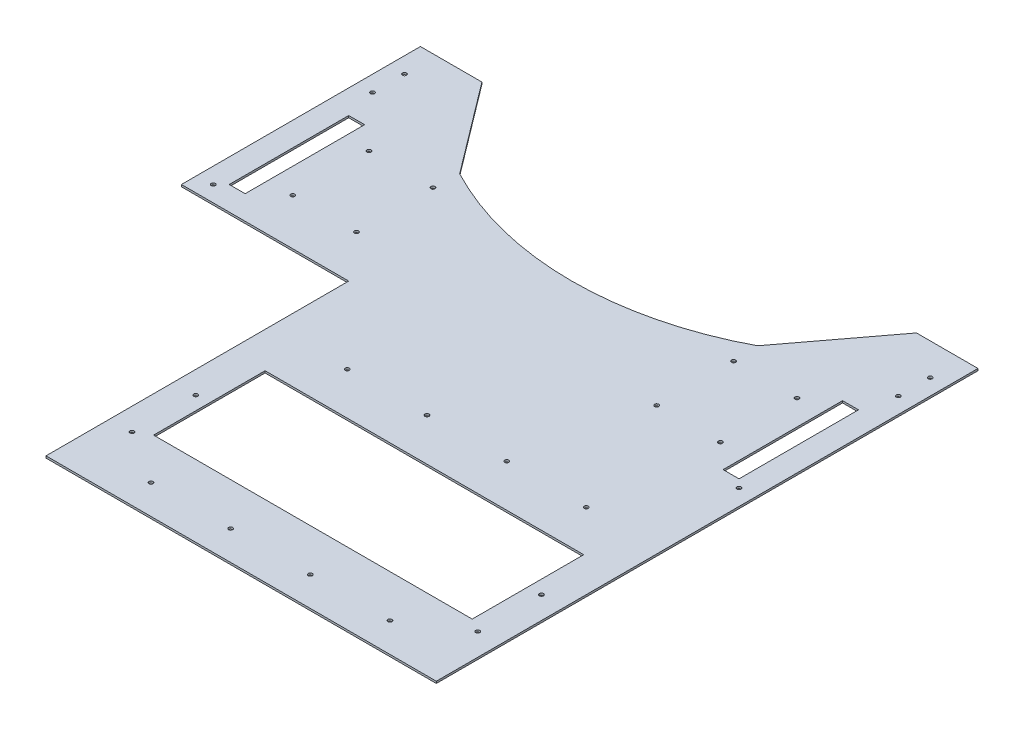
from build123d import *

# Parameters (mm, degrees)
SKETCH1_R           = 1.63195
SKETCH1_W           = 254
SKETCH1_H           = 88.9
SKETCH1_W_2         = 12.7
SKETCH1_H_2         = 95.25
BOSS_EXTRUDE1_DEPTH = 1.5875
CUT_EXTRUDE1_REACH  = 621.705
SKETCH2_R           = 1.63195
CUT_EXTRUDE2_REACH  = 621.705
SKETCH4_R           = 1.63195


with BuildPart() as part:
    # Sketch1 → Boss-Extrude1 (new body)
    with BuildSketch(Plane(origin=(0, 0, 0), x_dir=(1, 0, 0), z_dir=(0, 1, 0))):
        with BuildLine():
            Line((-444.5, 431.8), (-395.456941666, 431.8))
            Line((-395.456941666, 431.8), (-340.943704665, 359.56166268))
            ThreePointArc((-340.943704665, 359.56166268), (-222.25, 330.203093028), (-103.556295335, 359.56166268))
            Line((-103.556295335, 359.56166268), (-49.043058334, 431.8))
            Line((-49.043058334, 431.8), (0, 431.8))
            Line((0, 431.8), (0, 0))
            Line((0, 0), (-311.15, 0))
            Line((-311.15, 0), (-311.15, 241.3))
            Line((-311.15, 241.3), (-444.5, 241.3))
            Line((-444.5, 241.3), (-444.5, 431.8))
        make_face()
        with Locations(Location((-250.825, 23.368, 0), (0, 0, 270))):
            Circle(SKETCH1_R, mode=Mode.SUBTRACT)
        with Locations(Location((-187.325, 23.368, 0), (0, 0, 270))):
            Circle(SKETCH1_R, mode=Mode.SUBTRACT)
        with Locations(Location((-187.325, 179.8955, 0), (0, 0, 270))):
            Circle(SKETCH1_R, mode=Mode.SUBTRACT)
        with Locations(Location((-250.825, 179.8955, 0), (0, 0, 270))):
            Circle(SKETCH1_R, mode=Mode.SUBTRACT)
        with Locations(Location((-123.825, 179.8955, 0), (0, 0, 270))):
            Circle(SKETCH1_R, mode=Mode.SUBTRACT)
        with Locations(Location((-60.325, 179.8955, 0), (0, 0, 270))):
            Circle(SKETCH1_R, mode=Mode.SUBTRACT)
        with Locations(Location((-123.825, 23.368, 0), (0, 0, 270))):
            Circle(SKETCH1_R, mode=Mode.SUBTRACT)
        with Locations(Location((-60.325, 23.368, 0), (0, 0, 270))):
            Circle(SKETCH1_R, mode=Mode.SUBTRACT)
        with Locations((-155.575, 101.63175)):
            Rectangle(SKETCH1_W, SKETCH1_H, mode=Mode.SUBTRACT)
        with Locations((-25.4, 307.975)):
            Rectangle(SKETCH1_W_2, SKETCH1_H_2, mode=Mode.SUBTRACT)
        with Locations((-419.1, 307.975)):
            Rectangle(SKETCH1_W_2, SKETCH1_H_2, mode=Mode.SUBTRACT)
    extrude(amount=BOSS_EXTRUDE1_DEPTH)

    # Sketch2 → Cut-Extrude1 (cut, up to next)
    with BuildSketch(Plane(origin=(0, 1.5875, 0), x_dir=(1, 0, 0), z_dir=(0, 1, 0)), mode=Mode.PRIVATE) as cut_extrude1_sk1:
        with Locations(Location((-293.37, 101.6, 0), (0, 0, 270))):
            Circle(SKETCH2_R)
    cut_extrude1_tool1 = extrude(cut_extrude1_sk1.sketch, amount=-CUT_EXTRUDE1_REACH, mode=Mode.PRIVATE) & part.part
    # Sketch2 → Cut-Extrude1 (cut, up to next)
    with BuildSketch(Plane(origin=(0, 1.5875, 0), x_dir=(1, 0, 0), z_dir=(0, 1, 0)), mode=Mode.PRIVATE) as cut_extrude1_sk2:
        with Locations(Location((-293.37, 50.8, 0), (0, 0, 270))):
            Circle(SKETCH2_R)
    cut_extrude1_tool2 = extrude(cut_extrude1_sk2.sketch, amount=-CUT_EXTRUDE1_REACH, mode=Mode.PRIVATE) & part.part
    # Sketch2 → Cut-Extrude1 (cut, up to next)
    with BuildSketch(Plane(origin=(0, 1.5875, 0), x_dir=(1, 0, 0), z_dir=(0, 1, 0)), mode=Mode.PRIVATE) as cut_extrude1_sk3:
        with Locations(Location((-17.78, 101.6, 0), (0, 0, 270))):
            Circle(SKETCH2_R)
    cut_extrude1_tool3 = extrude(cut_extrude1_sk3.sketch, amount=-CUT_EXTRUDE1_REACH, mode=Mode.PRIVATE) & part.part
    # Sketch2 → Cut-Extrude1 (cut, up to next)
    with BuildSketch(Plane(origin=(0, 1.5875, 0), x_dir=(1, 0, 0), z_dir=(0, 1, 0)), mode=Mode.PRIVATE) as cut_extrude1_sk4:
        with Locations(Location((-17.78, 50.8, 0), (0, 0, 270))):
            Circle(SKETCH2_R)
    cut_extrude1_tool4 = extrude(cut_extrude1_sk4.sketch, amount=-CUT_EXTRUDE1_REACH, mode=Mode.PRIVATE) & part.part
    add(cut_extrude1_tool1.solids().sort_by_distance((-293.37, 1.5875, -101.6))[0], mode=Mode.SUBTRACT)
    add(cut_extrude1_tool2.solids().sort_by_distance((-293.37, 1.5875, -50.8))[0], mode=Mode.SUBTRACT)
    add(cut_extrude1_tool3.solids().sort_by_distance((-17.78, 1.5875, -101.6))[0], mode=Mode.SUBTRACT)
    add(cut_extrude1_tool4.solids().sort_by_distance((-17.78, 1.5875, -50.8))[0], mode=Mode.SUBTRACT)

    # Sketch4 → Cut-Extrude2 (cut, up to next)
    with BuildSketch(Plane(origin=(0, 1.5875, 0), x_dir=(1, 0, 0), z_dir=(0, 1, 0)), mode=Mode.PRIVATE) as cut_extrude2_sk1:
        with Locations(Location((-102.439928105, 339.392140239, 0), (0, 0, 270))):
            Circle(SKETCH4_R)
    cut_extrude2_tool1 = extrude(cut_extrude2_sk1.sketch, amount=-CUT_EXTRUDE2_REACH, mode=Mode.PRIVATE) & part.part
    # Sketch4 → Cut-Extrude2 (cut, up to next)
    with BuildSketch(Plane(origin=(0, 1.5875, 0), x_dir=(1, 0, 0), z_dir=(0, 1, 0)), mode=Mode.PRIVATE) as cut_extrude2_sk2:
        with Locations(Location((-51.640295705, 339.198883781, 0), (0, 0, 270))):
            Circle(SKETCH4_R)
    cut_extrude2_tool2 = extrude(cut_extrude2_sk2.sketch, amount=-CUT_EXTRUDE2_REACH, mode=Mode.PRIVATE) & part.part
    # Sketch4 → Cut-Extrude2 (cut, up to next)
    with BuildSketch(Plane(origin=(0, 1.5875, 0), x_dir=(1, 0, 0), z_dir=(0, 1, 0)), mode=Mode.PRIVATE) as cut_extrude2_sk3:
        with Locations(Location((-102.55625, 278.238883781, 0), (0, 0, 270))):
            Circle(SKETCH4_R)
    cut_extrude2_tool3 = extrude(cut_extrude2_sk3.sketch, amount=-CUT_EXTRUDE2_REACH, mode=Mode.PRIVATE) & part.part
    # Sketch4 → Cut-Extrude2 (cut, up to next)
    with BuildSketch(Plane(origin=(0, 1.5875, 0), x_dir=(1, 0, 0), z_dir=(0, 1, 0)), mode=Mode.PRIVATE) as cut_extrude2_sk4:
        with Locations(Location((-51.75625, 278.238883781, 0), (0, 0, 270))):
            Circle(SKETCH4_R)
    cut_extrude2_tool4 = extrude(cut_extrude2_sk4.sketch, amount=-CUT_EXTRUDE2_REACH, mode=Mode.PRIVATE) & part.part
    # Sketch4 → Cut-Extrude2 (cut, up to next)
    with BuildSketch(Plane(origin=(0, 1.5875, 0), x_dir=(1, 0, 0), z_dir=(0, 1, 0)), mode=Mode.PRIVATE) as cut_extrude2_sk5:
        with Locations(Location((-392.74375, 278.238883781, 0), (0, 0, 270))):
            Circle(SKETCH4_R)
    cut_extrude2_tool5 = extrude(cut_extrude2_sk5.sketch, amount=-CUT_EXTRUDE2_REACH, mode=Mode.PRIVATE) & part.part
    # Sketch4 → Cut-Extrude2 (cut, up to next)
    with BuildSketch(Plane(origin=(0, 1.5875, 0), x_dir=(1, 0, 0), z_dir=(0, 1, 0)), mode=Mode.PRIVATE) as cut_extrude2_sk6:
        with Locations(Location((-341.94375, 278.238883781, 0), (0, 0, 270))):
            Circle(SKETCH4_R)
    cut_extrude2_tool6 = extrude(cut_extrude2_sk6.sketch, amount=-CUT_EXTRUDE2_REACH, mode=Mode.PRIVATE) & part.part
    # Sketch4 → Cut-Extrude2 (cut, up to next)
    with BuildSketch(Plane(origin=(0, 1.5875, 0), x_dir=(1, 0, 0), z_dir=(0, 1, 0)), mode=Mode.PRIVATE) as cut_extrude2_sk7:
        with Locations(Location((-392.859704295, 339.198883781, 0), (0, 0, 270))):
            Circle(SKETCH4_R)
    cut_extrude2_tool7 = extrude(cut_extrude2_sk7.sketch, amount=-CUT_EXTRUDE2_REACH, mode=Mode.PRIVATE) & part.part
    # Sketch4 → Cut-Extrude2 (cut, up to next)
    with BuildSketch(Plane(origin=(0, 1.5875, 0), x_dir=(1, 0, 0), z_dir=(0, 1, 0)), mode=Mode.PRIVATE) as cut_extrude2_sk8:
        with Locations(Location((-342.060071895, 339.392140239, 0), (0, 0, 270))):
            Circle(SKETCH4_R)
    cut_extrude2_tool8 = extrude(cut_extrude2_sk8.sketch, amount=-CUT_EXTRUDE2_REACH, mode=Mode.PRIVATE) & part.part
    # Sketch4 → Cut-Extrude2 (cut, up to next)
    with BuildSketch(Plane(origin=(0, 1.5875, 0), x_dir=(1, 0, 0), z_dir=(0, 1, 0)), mode=Mode.PRIVATE) as cut_extrude2_sk9:
        with Locations(Location((-12.7, 406.4, 0), (0, 0, 270))):
            Circle(SKETCH4_R)
    cut_extrude2_tool9 = extrude(cut_extrude2_sk9.sketch, amount=-CUT_EXTRUDE2_REACH, mode=Mode.PRIVATE) & part.part
    # Sketch4 → Cut-Extrude2 (cut, up to next)
    with BuildSketch(Plane(origin=(0, 1.5875, 0), x_dir=(1, 0, 0), z_dir=(0, 1, 0)), mode=Mode.PRIVATE) as cut_extrude2_sk10:
        with Locations(Location((-12.7, 381, 0), (0, 0, 270))):
            Circle(SKETCH4_R)
    cut_extrude2_tool10 = extrude(cut_extrude2_sk10.sketch, amount=-CUT_EXTRUDE2_REACH, mode=Mode.PRIVATE) & part.part
    # Sketch4 → Cut-Extrude2 (cut, up to next)
    with BuildSketch(Plane(origin=(0, 1.5875, 0), x_dir=(1, 0, 0), z_dir=(0, 1, 0)), mode=Mode.PRIVATE) as cut_extrude2_sk11:
        with Locations(Location((-12.7, 254, 0), (0, 0, 270))):
            Circle(SKETCH4_R)
    cut_extrude2_tool11 = extrude(cut_extrude2_sk11.sketch, amount=-CUT_EXTRUDE2_REACH, mode=Mode.PRIVATE) & part.part
    # Sketch4 → Cut-Extrude2 (cut, up to next)
    with BuildSketch(Plane(origin=(0, 1.5875, 0), x_dir=(1, 0, 0), z_dir=(0, 1, 0)), mode=Mode.PRIVATE) as cut_extrude2_sk12:
        with Locations(Location((-431.8, 254, 0), (0, 0, 270))):
            Circle(SKETCH4_R)
    cut_extrude2_tool12 = extrude(cut_extrude2_sk12.sketch, amount=-CUT_EXTRUDE2_REACH, mode=Mode.PRIVATE) & part.part
    # Sketch4 → Cut-Extrude2 (cut, up to next)
    with BuildSketch(Plane(origin=(0, 1.5875, 0), x_dir=(1, 0, 0), z_dir=(0, 1, 0)), mode=Mode.PRIVATE) as cut_extrude2_sk13:
        with Locations(Location((-431.8, 381, 0), (0, 0, 270))):
            Circle(SKETCH4_R)
    cut_extrude2_tool13 = extrude(cut_extrude2_sk13.sketch, amount=-CUT_EXTRUDE2_REACH, mode=Mode.PRIVATE) & part.part
    # Sketch4 → Cut-Extrude2 (cut, up to next)
    with BuildSketch(Plane(origin=(0, 1.5875, 0), x_dir=(1, 0, 0), z_dir=(0, 1, 0)), mode=Mode.PRIVATE) as cut_extrude2_sk14:
        with Locations(Location((-431.8, 406.4, 0), (0, 0, 270))):
            Circle(SKETCH4_R)
    cut_extrude2_tool14 = extrude(cut_extrude2_sk14.sketch, amount=-CUT_EXTRUDE2_REACH, mode=Mode.PRIVATE) & part.part
    add(cut_extrude2_tool1.solids().sort_by_distance((-102.439928, 1.5875, -339.39214))[0], mode=Mode.SUBTRACT)
    add(cut_extrude2_tool2.solids().sort_by_distance((-51.640296, 1.5875, -339.198884))[0], mode=Mode.SUBTRACT)
    add(cut_extrude2_tool3.solids().sort_by_distance((-102.55625, 1.5875, -278.238884))[0], mode=Mode.SUBTRACT)
    add(cut_extrude2_tool4.solids().sort_by_distance((-51.75625, 1.5875, -278.238884))[0], mode=Mode.SUBTRACT)
    add(cut_extrude2_tool5.solids().sort_by_distance((-392.74375, 1.5875, -278.238884))[0], mode=Mode.SUBTRACT)
    add(cut_extrude2_tool6.solids().sort_by_distance((-341.94375, 1.5875, -278.238884))[0], mode=Mode.SUBTRACT)
    add(cut_extrude2_tool7.solids().sort_by_distance((-392.859704, 1.5875, -339.198884))[0], mode=Mode.SUBTRACT)
    add(cut_extrude2_tool8.solids().sort_by_distance((-342.060072, 1.5875, -339.39214))[0], mode=Mode.SUBTRACT)
    add(cut_extrude2_tool9.solids().sort_by_distance((-12.7, 1.5875, -406.4))[0], mode=Mode.SUBTRACT)
    add(cut_extrude2_tool10.solids().sort_by_distance((-12.7, 1.5875, -381))[0], mode=Mode.SUBTRACT)
    add(cut_extrude2_tool11.solids().sort_by_distance((-12.7, 1.5875, -254))[0], mode=Mode.SUBTRACT)
    add(cut_extrude2_tool12.solids().sort_by_distance((-431.8, 1.5875, -254))[0], mode=Mode.SUBTRACT)
    add(cut_extrude2_tool13.solids().sort_by_distance((-431.8, 1.5875, -381))[0], mode=Mode.SUBTRACT)
    add(cut_extrude2_tool14.solids().sort_by_distance((-431.8, 1.5875, -406.4))[0], mode=Mode.SUBTRACT)


solid = part.part
